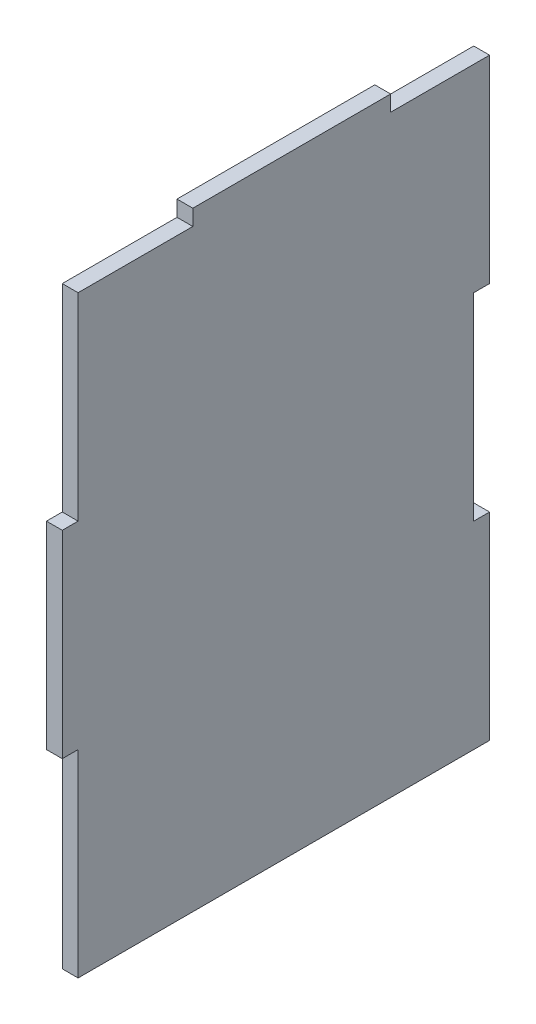
from build123d import *

# Parameters (mm, degrees)
BOSS_EXTRUDE1_DEPTH = 4


with BuildPart() as part:
    # Sketch1 → Boss-Extrude1 (new body)
    with BuildSketch(Plane(origin=(0, 0, 0), x_dir=(0, 0, -1), z_dir=(1, 0, 0))):
        Polygon((0, 0), (100, 0), (100, 50), (96, 50), (96, 100), (100, 100), (100, 150), (75, 150), (75, 154), (25, 154), (25, 150), (0, 150), (-4, 150), (-4, 100), (-8, 100), (-8, 50), (-4, 50), (-4, 0), align=None)
    extrude(amount=BOSS_EXTRUDE1_DEPTH)


solid = part.part
